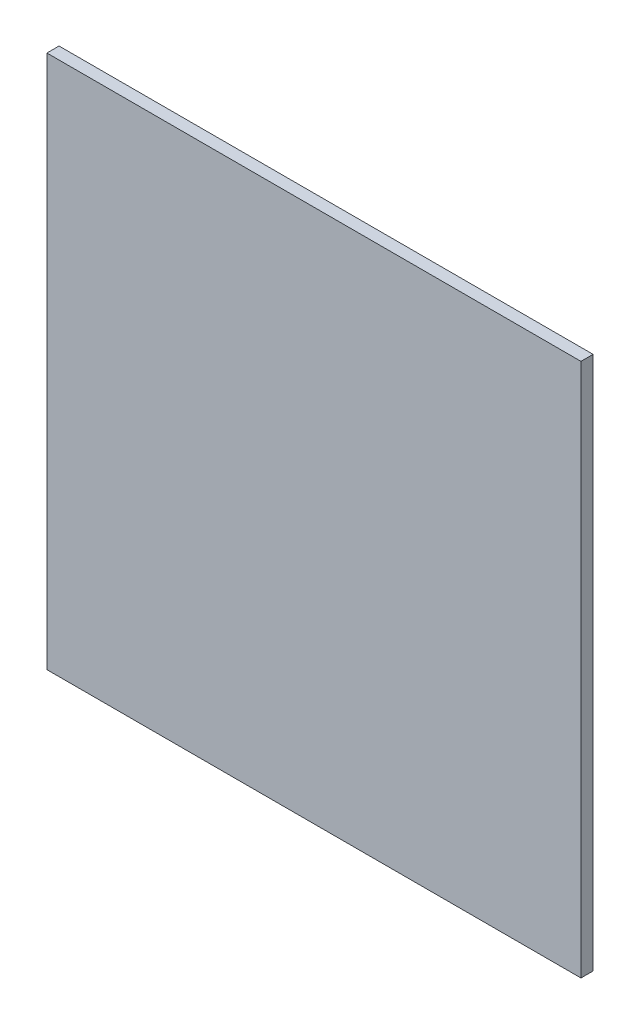
from build123d import *

# Parameters (mm, degrees)
ESQUISSE1_W        = 44
ESQUISSE1_H        = 44
BOSS_EXTRU_1_DEPTH = 1


with BuildPart() as part:
    # Esquisse1 → Boss.-Extru.1 (new body)
    with BuildSketch(Plane.XY):
        Rectangle(ESQUISSE1_W, ESQUISSE1_H)
    extrude(amount=BOSS_EXTRU_1_DEPTH)


solid = part.part
